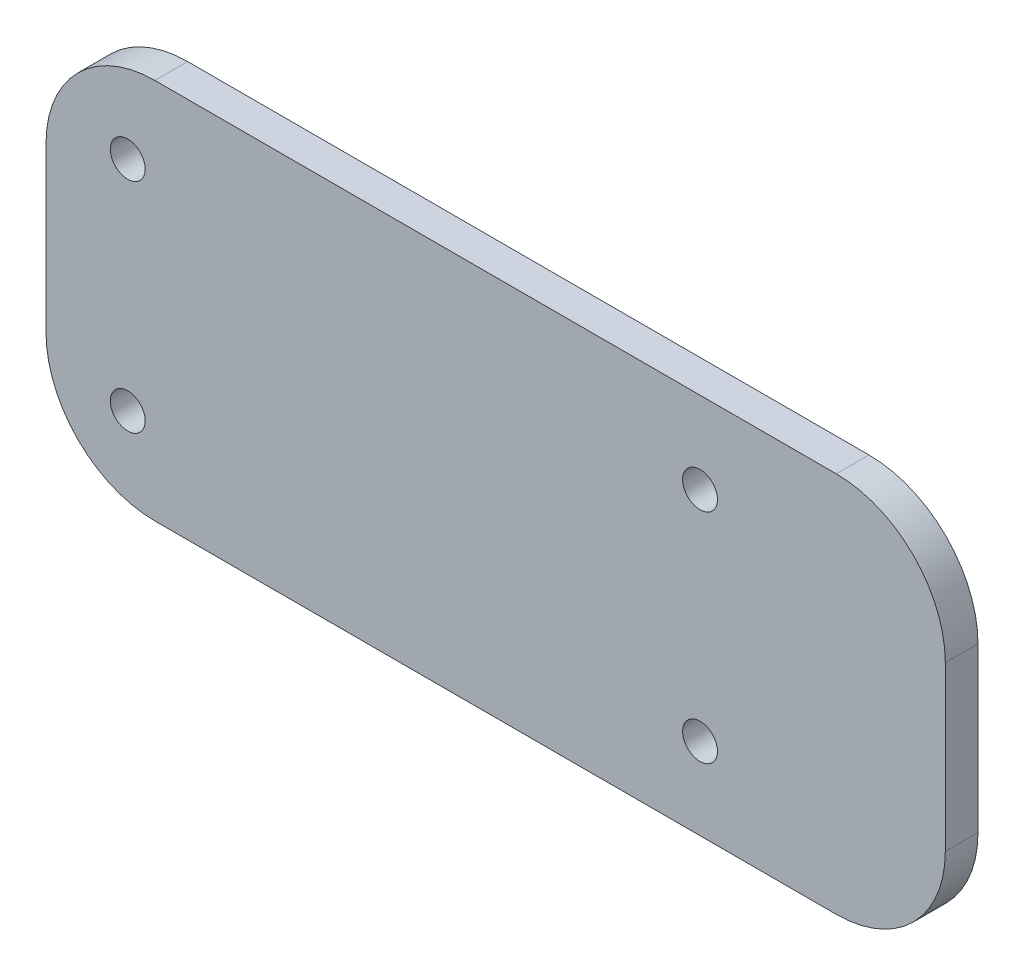
from build123d import *

# Parameters (mm, degrees)
SKETCH_1_R      = 1.6
EXTRUDE_1_DEPTH = 3
FILLET_1_R      = 10


with BuildPart() as part:
    # 草图1 → 凸台-拉伸1 (new body)
    with BuildSketch(Plane.XY):
        Polygon((33.75, 17.5), (48.75, 17.5), (48.75, -17.5), (33.75, -17.5), (-33.75, -17.5), (-33.75, 17.5), align=None)
        with Locations((-26.25, 10)):
            Circle(SKETCH_1_R, mode=Mode.SUBTRACT)
        with Locations((-26.25, -10)):
            Circle(SKETCH_1_R, mode=Mode.SUBTRACT)
        with Locations((26.25, -10)):
            Circle(SKETCH_1_R, mode=Mode.SUBTRACT)
        with Locations((26.25, 10)):
            Circle(SKETCH_1_R, mode=Mode.SUBTRACT)
    extrude(amount=EXTRUDE_1_DEPTH)

    # 圆角1
    fillet_1_edges = [part.edges().sort_by_distance(p)[0] for p in [
        (48.75, 17.5, 1.5),
        (48.75, -17.5, 1.5),
        (-33.75, -17.5, 1.5),
        (-33.75, 17.5, 1.5),
    ]]
    fillet(fillet_1_edges, radius=FILLET_1_R)


solid = part.part
